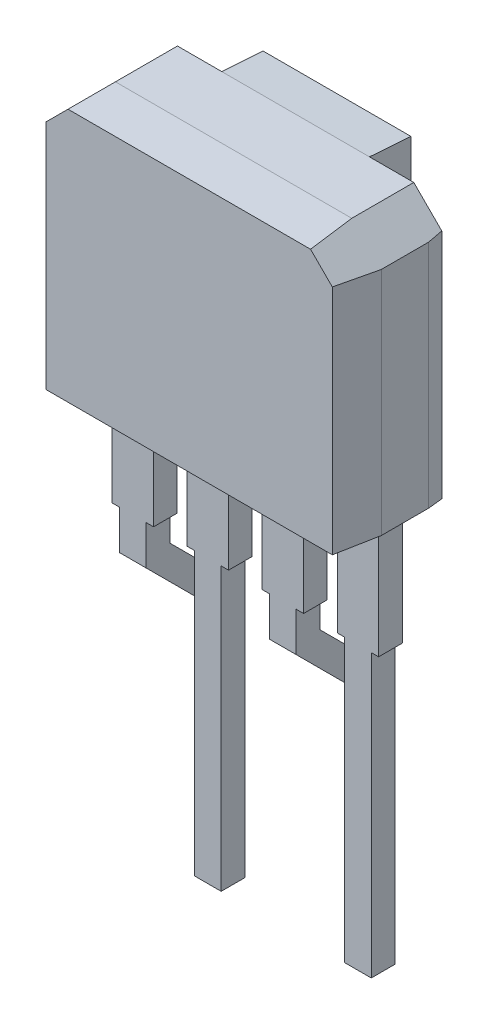
from build123d import *
from OCP.BRepFilletAPI import BRepFilletAPI_MakeChamfer

# Parameters (mm, degrees)
BOSS_EXTRUDE1_DEPTH = 4.4
CHAMFER5_SIZE       = 0.5
CHAMFER1_SIZE       = 0.25
CHAMFER1_SIZE2      = 0.026276059
CHAMFER2_SIZE       = 0.75
CHAMFER2_SIZE2      = 0.078828176
CHAMFER3_SIZE       = 0.75
CHAMFER3_SIZE2      = 0.052445109
CHAMFER4_SIZE       = 0.7
CHAMFER4_SIZE2      = 0.048948768
BOSS_EXTRUDE2_START = 0.41
BOSS_EXTRUDE2_DEPTH = 0.45
BOSS_EXTRUDE3_START = 1.68
SKETCH5_W           = 0.4
SKETCH5_H           = 6.77
BOSS_EXTRUDE3_DEPTH = 0.45
LPATTERN1_COUNT     = 2
LPATTERN1_PITCH     = 2.54
SKETCH6_W           = 0.125
SKETCH6_H           = 2
BOSS_EXTRUDE4_DEPTH = 0.4
LPATTERN2_COUNT     = 4
LPATTERN2_PITCH     = 1.27


with BuildPart() as part:
    # Sketch1 → Boss-Extrude1 (new body)
    with BuildSketch(Plane(origin=(0, 0, 0), x_dir=(1, 0, 0), z_dir=(0, 1, 0))):
        Polygon((-2.5, 0), (-2.5, 1.8), (-1.25, 1.8), (-1.25, 2.5), (1.25, 2.5), (1.25, 1.8), (2.5, 1.8), (2.5, 0), align=None)
    extrude(amount=BOSS_EXTRUDE1_DEPTH)

    # Chamfer5
    chamfer5_edges = [part.edges().sort_by_distance(p)[0] for p in [
        (-2.5, 4.4, -0.9),
        (2.5, 4.4, -0.9),
    ]]
    chamfer(chamfer5_edges, length=CHAMFER5_SIZE)

    # Chamfer1: one chamfer whose edges measure the first distance from different faces: ONE call of the kernel's chamfer builder (chamfer() names one face for all edges)
    chamfer1_edges_1 = [part.edges().sort_by_distance(p)[0] for p in [
        (2.5, 1.95, -1.8),
    ]]
    chamfer1_side_1 = [part.faces().sort_by_distance(p)[0] for p in [
        (2.5, 1.95, -0.9),
    ]]
    chamfer1_edges_2 = [part.edges().sort_by_distance(p)[0] for p in [
        (-2.5, 1.95, -1.8),
    ]]
    chamfer1_side_2 = [part.faces().sort_by_distance(p)[0] for p in [
        (-2.5, 1.95, -0.9),
    ]]
    chamfer1 = BRepFilletAPI_MakeChamfer(part.part.solid().wrapped)
    for e in chamfer1_edges_1:
        chamfer1.Add(CHAMFER1_SIZE, CHAMFER1_SIZE2, e.wrapped, chamfer1_side_1[0].wrapped)  # the first distance lies on this face
    for e in chamfer1_edges_2:
        chamfer1.Add(CHAMFER1_SIZE, CHAMFER1_SIZE2, e.wrapped, chamfer1_side_2[0].wrapped)  # the first distance lies on this face
    add(Compound.cast(chamfer1.Shape()), mode=Mode.REPLACE)

    # Chamfer2: one chamfer whose edges measure the first distance from different faces: ONE call of the kernel's chamfer builder (chamfer() names one face for all edges)
    chamfer2_edges_1 = [part.edges().sort_by_distance(p)[0] for p in [
        (2.5, 1.95, 0),
    ]]
    chamfer2_side_1 = [part.faces().sort_by_distance(p)[0] for p in [
        (2.5, 1.95, -0.775),
    ]]
    chamfer2_edges_2 = [part.edges().sort_by_distance(p)[0] for p in [
        (-2.5, 1.95, 0),
    ]]
    chamfer2_side_2 = [part.faces().sort_by_distance(p)[0] for p in [
        (-2.5, 1.95, -0.775),
    ]]
    chamfer2 = BRepFilletAPI_MakeChamfer(part.part.solid().wrapped)
    for e in chamfer2_edges_1:
        chamfer2.Add(CHAMFER2_SIZE, CHAMFER2_SIZE2, e.wrapped, chamfer2_side_1[0].wrapped)  # the first distance lies on this face
    for e in chamfer2_edges_2:
        chamfer2.Add(CHAMFER2_SIZE, CHAMFER2_SIZE2, e.wrapped, chamfer2_side_2[0].wrapped)  # the first distance lies on this face
    add(Compound.cast(chamfer2.Shape()), mode=Mode.REPLACE)

    # Chamfer3: one chamfer whose edges measure the first distance from different faces: ONE call of the kernel's chamfer builder (chamfer() names one face for all edges)
    chamfer3_edges_1 = [part.edges().sort_by_distance(p)[0] for p in [
        (0, 4.4, 0),
    ]]
    chamfer3_side_1 = [part.faces().sort_by_distance(p)[0] for p in [
        (0, 4.4, -1.144413408),
    ]]
    chamfer3_edges_2 = [part.edges().sort_by_distance(p)[0] for p in [
        (0, 0, 0),
    ]]
    chamfer3_side_2 = [part.faces().sort_by_distance(p)[0] for p in [
        (0, 0, -1.107834111),
    ]]
    chamfer3 = BRepFilletAPI_MakeChamfer(part.part.solid().wrapped)
    for e in chamfer3_edges_1:
        chamfer3.Add(CHAMFER3_SIZE, CHAMFER3_SIZE2, e.wrapped, chamfer3_side_1[0].wrapped)  # the first distance lies on this face
    for e in chamfer3_edges_2:
        chamfer3.Add(CHAMFER3_SIZE, CHAMFER3_SIZE2, e.wrapped, chamfer3_side_2[0].wrapped)  # the first distance lies on this face
    add(Compound.cast(chamfer3.Shape()), mode=Mode.REPLACE)

    # Chamfer4: one chamfer whose edges measure the first distance from different faces: ONE call of the kernel's chamfer builder (chamfer() names one face for all edges)
    chamfer4_edges_1 = [part.edges().sort_by_distance(p)[0] for p in [
        (0, 0, -2.5),
    ]]
    chamfer4_side_1 = [part.faces().sort_by_distance(p)[0] for p in [
        (0, 0, -1.493540612),
    ]]
    chamfer4_edges_2 = [part.edges().sort_by_distance(p)[0] for p in [
        (0, 4.4, -2.5),
    ]]
    chamfer4_side_2 = [part.faces().sort_by_distance(p)[0] for p in [
        (0, 4.4, -1.532352941),
    ]]
    chamfer4 = BRepFilletAPI_MakeChamfer(part.part.solid().wrapped)
    for e in chamfer4_edges_1:
        chamfer4.Add(CHAMFER4_SIZE, CHAMFER4_SIZE2, e.wrapped, chamfer4_side_1[0].wrapped)  # the first distance lies on this face
    for e in chamfer4_edges_2:
        chamfer4.Add(CHAMFER4_SIZE, CHAMFER4_SIZE2, e.wrapped, chamfer4_side_2[0].wrapped)  # the first distance lies on this face
    add(Compound.cast(chamfer4.Shape()), mode=Mode.REPLACE)

    # Sketch4 → Boss-Extrude2 (add)
    with BuildSketch(Plane(origin=(0, 0, 0), x_dir=(0, 0, -1), z_dir=(1, 0, 0)).offset(BOSS_EXTRUDE2_START)):
        Polygon((0.95, 0), (0.95, -2.665685425), (2.22, -3.935685425), (2.22, -6.77), (2.62, -6.77), (2.62, -3.77), (1.35, -2.5), (1.35, 0), align=None)
    boss_extrude2 = extrude(amount=BOSS_EXTRUDE2_DEPTH)

    # Sketch5 → Boss-Extrude3 (add)
    with BuildSketch(Plane(origin=(0, 0, 0), x_dir=(0, 0, -1), z_dir=(1, 0, 0)).offset(BOSS_EXTRUDE3_START)):
        with Locations((1.15, -3.385)):
            Rectangle(SKETCH5_W, SKETCH5_H)
    boss_extrude3 = extrude(amount=BOSS_EXTRUDE3_DEPTH)

    # LPattern1: Boss-Extrude2, Boss-Extrude3 ×2
    with Locations(*[(-i * LPATTERN1_PITCH, 0, 0) for i in range(1, LPATTERN1_COUNT)]):
        add(boss_extrude2)
        add(boss_extrude3)

    # Sketch6 → Boss-Extrude4 (add)
    with BuildSketch(Plane(origin=(0, 0, -1.35), x_dir=(-1, 0, 0), z_dir=(0, 0, -1))):
        with Locations((-2.1925, -1)):
            Rectangle(SKETCH6_W, SKETCH6_H)
        with Locations((-1.6175, -1)):
            Rectangle(SKETCH6_W, SKETCH6_H)
    boss_extrude4 = extrude(amount=-BOSS_EXTRUDE4_DEPTH)

    # LPattern2: Boss-Extrude4 ×4
    with Locations(*[(-i * LPATTERN2_PITCH, 0, 0) for i in range(1, LPATTERN2_COUNT)]):
        add(boss_extrude4)


solid = part.part
